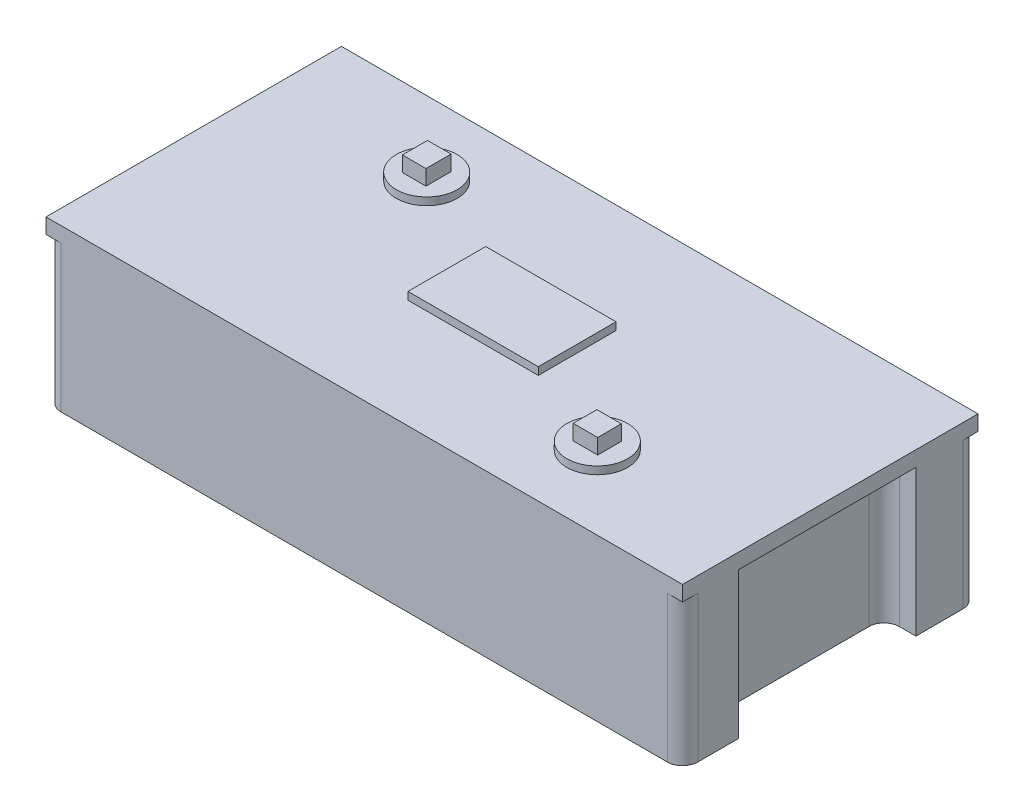
from build123d import *

# Parameters (mm, degrees)
BOSS_EXTRUDE2_DEPTH = 96
SKETCH2_W           = 418
SKETCH2_H           = 194
BOSS_EXTRUDE3_DEPTH = 10
SKETCH3_R           = 20
BOSS_EXTRUDE5_DEPTH = 15
SKETCH3_4_W         = 15.513986376
SKETCH3_4_H         = 16.487812262
SKETCH3_4_W_2       = 16.085927628
SKETCH3_4_H_2       = 15.566266702
BOSS_EXTRUDE6_DEPTH = 25
SKETCH3_6_R         = 20
BOSS_EXTRUDE7_DEPTH = 15
SKETCH4_W           = 85.572953824
SKETCH4_H           = 51.067730508
BOSS_EXTRUDE8_DEPTH = 15


with BuildPart() as part:
    # Sketch1 → Boss-Extrude2 (new body)
    with BuildSketch(Plane(origin=(0, 0, 0), x_dir=(1, 0, 0), z_dir=(0, 1, 0))):
        with BuildLine():
            Line((-209, -60.2), (-209, -87))
            ThreePointArc((-209, -87), (-206.071067812, -94.071067812), (-199, -97))
            Line((-199, -97), (199, -97))
            ThreePointArc((199, -97), (206.071067812, -94.071067812), (209, -87))
            Line((209, -87), (209, -60.2))
            Line((209, -60.2), (198.157814389, -60.2))
            ThreePointArc((198.157814389, -60.2), (191.086746578, -57.271067812), (188.157814389, -50.2))
            Line((188.157814389, -50.2), (188.157814389, 46.20183264))
            ThreePointArc((188.157814389, 46.20183264), (191.086746578, 53.272900452), (198.157814389, 56.20183264))
            Line((198.157814389, 56.20183264), (209, 56.20183264))
            Line((209, 56.20183264), (209, 87))
            ThreePointArc((209, 87), (206.071067812, 94.071067812), (199, 97))
            Line((199, 97), (-199, 97))
            ThreePointArc((-199, 97), (-206.071067812, 94.071067812), (-209, 87))
            Line((-209, 87), (-209, 56.20183264))
            Line((-209, 56.20183264), (-198.157814389, 56.20183264))
            ThreePointArc((-198.157814389, 56.20183264), (-191.086746578, 53.272900452), (-188.157814389, 46.20183264))
            Line((-188.157814389, 46.20183264), (-188.157814389, -50.2))
            ThreePointArc((-188.157814389, -50.2), (-191.086746578, -57.271067812), (-198.157814389, -60.2))
            Line((-198.157814389, -60.2), (-209, -60.2))
        make_face()
    extrude(amount=BOSS_EXTRUDE2_DEPTH)

    # Sketch2 → Boss-Extrude3 (add)
    with BuildSketch(Plane(origin=(0, 96, 0), x_dir=(1, 0, 0), z_dir=(0, 1, 0))):
        Rectangle(SKETCH2_W, SKETCH2_H)
    extrude(amount=BOSS_EXTRUDE3_DEPTH)

    # Sketch3 → Boss-Extrude5 (add)
    with BuildSketch(Plane(origin=(0, 96, 0), x_dir=(1, 0, 0), z_dir=(0, 1, 0))):
        with Locations((-104.5, 48.5)):
            Circle(SKETCH3_R)
    extrude(amount=BOSS_EXTRUDE5_DEPTH)

    # Sketch3<4> → Boss-Extrude6 (add)
    with BuildSketch(Plane(origin=(0, 96, 0), x_dir=(1, 0, 0), z_dir=(0, 1, 0))):
        with Locations((-104.5, 48.5)):
            Rectangle(SKETCH3_4_W, SKETCH3_4_H)
        with Locations((104.5, -48.5)):
            Rectangle(SKETCH3_4_W_2, SKETCH3_4_H_2)
    extrude(amount=BOSS_EXTRUDE6_DEPTH)

    # Sketch3<6> → Boss-Extrude7 (add)
    with BuildSketch(Plane(origin=(0, 96, 0), x_dir=(1, 0, 0), z_dir=(0, 1, 0))):
        with Locations((104.5, -48.5)):
            Circle(SKETCH3_6_R)
    extrude(amount=BOSS_EXTRUDE7_DEPTH)

    # Sketch4 → Boss-Extrude8 (add)
    with BuildSketch(Plane(origin=(0, 96, 0), x_dir=(1, 0, 0), z_dir=(0, 1, 0))):
        Rectangle(SKETCH4_W, SKETCH4_H)
    extrude(amount=BOSS_EXTRUDE8_DEPTH)


solid = part.part
